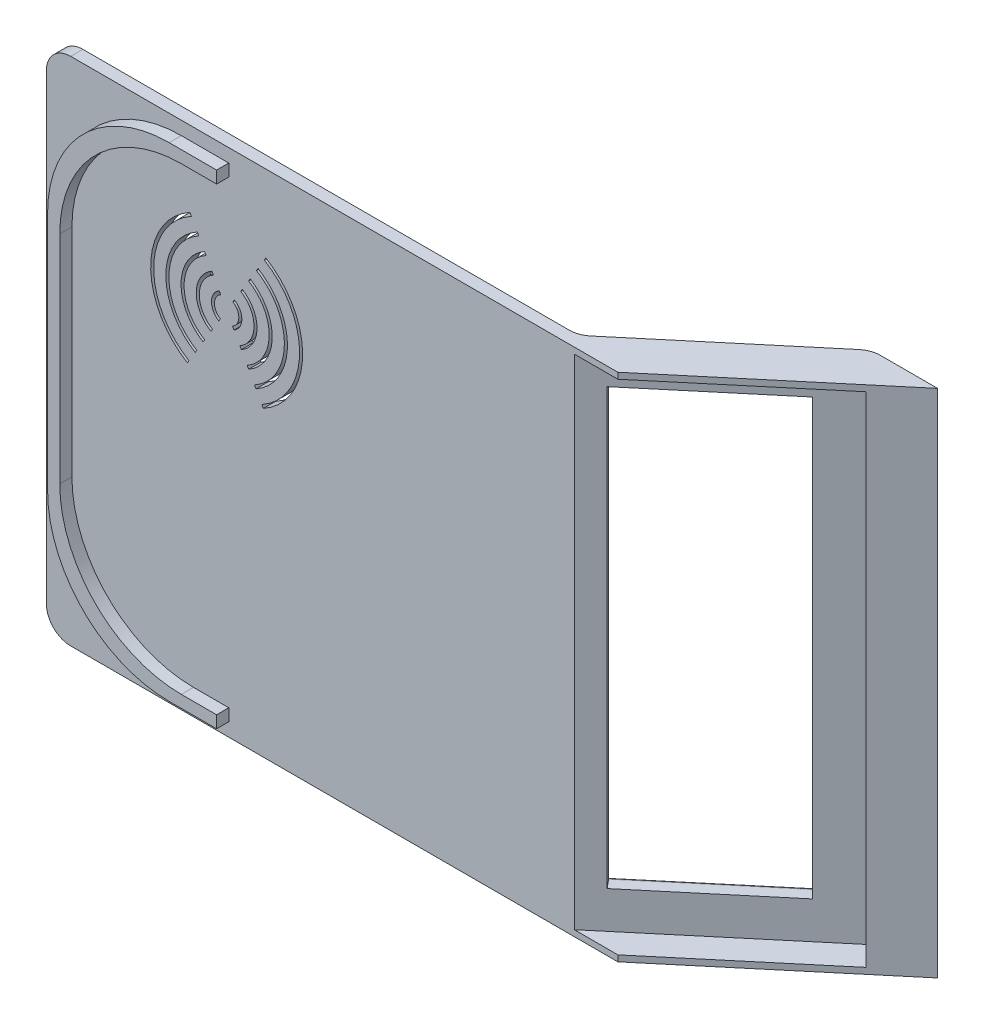
from build123d import *
from OCP.BRepFilletAPI import BRepFilletAPI_MakeFillet

# Parameters (mm, degrees)
BOSS_EXTRUDE1_DEPTH = 84
CUT_EXTRUDE2_START  = -1
CUT_EXTRUDE2_DEPTH  = 82
CUT_EXTRUDE3_START  = 4.4
CUT_EXTRUDE3_DEPTH  = 71.5
CUT_EXTRUDE4_DEPTH  = 84
FILLET2_R1          = 4
FILLET2_R2          = 0.5
BOSS_EXTRUDE3_DEPTH = 2
CUT_EXTRUDE5_DEPTH  = 4


with BuildPart() as part:
    # Sketch1 → Boss-Extrude1 (new body)
    with BuildSketch(Plane(origin=(0, 0, 0), x_dir=(1, 0, 0), z_dir=(0, 1, 0))):
        Polygon((0, 0), (38.302222156, 32.139380484), (42.801735424, 26.777069382), (8.506559603, -2), (-85.5, -2), (-85.5, 0), align=None)
    extrude(amount=BOSS_EXTRUDE1_DEPTH)

    # Sketch5 → Cut-Extrude2 (cut)
    with BuildSketch(Plane(origin=(0, 84, 0), x_dir=(1, 0, 0), z_dir=(0, 1, 0)).offset(CUT_EXTRUDE2_START)):
        Polygon((8.506559603, -2), (30.721848453, 16.640840681), (27.765025449, 20.164645119), (1.350229999, -2), align=None)
    extrude(amount=-CUT_EXTRUDE2_DEPTH, mode=Mode.SUBTRACT)

    # Sketch7 → Cut-Extrude3 (cut)
    with BuildSketch(Plane.XZ.offset(-83).offset(CUT_EXTRUDE3_START)):
        Polygon((4.285763267, -0.463204882), (-0.306577305, -5.936143258), (18.078489329, -21.363045891), (22.670829902, -15.890107515), align=None)
    extrude(amount=CUT_EXTRUDE3_DEPTH, mode=Mode.SUBTRACT)

    # Sketch8 → Cut-Extrude4 (cut)
    with BuildSketch(Plane.XZ):
        Polygon((42.801735424, -26.777069382), (37.108645825, -22), (26.218579037, -22), (38.302222156, -32.139380484), align=None)
    extrude(amount=-CUT_EXTRUDE4_DEPTH, mode=Mode.SUBTRACT)

    # Fillet2: one fillet with a radius per group of edges: ONE call of the kernel's fillet builder (fillet() takes one radius for all edges)
    fillet2_edges_1 = [part.edges().sort_by_distance(p)[0] for p in [
        (0, 42, 0),
        (-85.5, 84, 1),
        (26.218579037, 42, -22),
        (-85.5, 0, 1),
    ]]
    fillet2_edges_2 = [part.edges().sort_by_distance(p)[0] for p in [
        (11.935606321, 7.1, -10.015162862),
        (2.743073004, 42.85, -2.301711546),
        (21.128139639, 42.85, -17.728614178),
        (11.935606321, 78.6, -10.015162862),
    ]]
    fillet2 = BRepFilletAPI_MakeFillet(part.part.solid().wrapped)
    for e in fillet2_edges_1:
        fillet2.Add(FILLET2_R1, e.wrapped)
    for e in fillet2_edges_2:
        fillet2.Add(FILLET2_R2, e.wrapped)
    add(Compound.cast(fillet2.Shape()), mode=Mode.REPLACE)

    # Sketch10 → Boss-Extrude3 (add)
    with BuildSketch(Plane.XY.offset(2)):
        with BuildLine():
            Line((-55.5, 79.8), (-55.5, 81.8))
            Line((-55.5, 81.8), (-63.3, 81.8))
            ThreePointArc((-63.3, 81.8), (-77.442135624, 75.942135624), (-83.3, 61.8))
            Line((-83.3, 61.8), (-83.3, 22.2))
            ThreePointArc((-83.3, 22.2), (-77.442135624, 8.057864376), (-63.3, 2.2))
            Line((-63.3, 2.2), (-55.5, 2.2))
            Line((-55.5, 2.2), (-55.5, 4.2))
            Line((-55.5, 4.2), (-61.3, 4.2))
            ThreePointArc((-61.3, 4.2), (-75.442135624, 10.057864376), (-81.3, 24.2))
            Line((-81.3, 24.2), (-81.3, 59.8))
            ThreePointArc((-81.3, 59.8), (-75.442135624, 73.942135624), (-61.3, 79.8))
            Line((-61.3, 79.8), (-55.5, 79.8))
        make_face()
    extrude(amount=BOSS_EXTRUDE3_DEPTH)

    # Sketch11 → Cut-Extrude5 (cut)
    with BuildSketch(Plane(origin=(0, 0, 0), x_dir=(-1, 0, 0), z_dir=(0, 0, -1))):
        with BuildLine():
            ThreePointArc((49.386884986, 71.331085509), (43.350190066, 60.385387064), (49.811095522, 49.684606686))
            Line((49.811095522, 49.684606686), (50.052563318, 50.122434624))
            ThreePointArc((50.052563318, 50.122434624), (43.850094081, 60.395183787), (49.645321205, 70.903054294))
            Line((49.645321205, 70.903054294), (49.386884986, 71.331085509))
        make_face()
        with BuildLine():
            Line((62.050259679, 50.357555968), (62.308695897, 49.929524753))
            ThreePointArc((62.308695897, 49.929524753), (68.345390817, 60.875223198), (61.884485362, 71.576003576))
            Line((61.884485362, 71.576003576), (61.643017565, 71.138175638))
            ThreePointArc((61.643017565, 71.138175638), (67.845486802, 60.865426475), (62.050259679, 50.357555968))
        make_face()
        with BuildLine():
            ThreePointArc((50.679066077, 69.190929433), (45.849710141, 60.434370678), (51.018434506, 51.873746375))
            Line((51.018434506, 51.873746375), (51.259902302, 52.311574313))
            ThreePointArc((51.259902302, 52.311574313), (46.349614156, 60.4441674), (50.937502296, 68.762898218))
            Line((50.937502296, 68.762898218), (50.679066077, 69.190929433))
        make_face()
        with BuildLine():
            Line((60.758078588, 52.497712044), (61.016514806, 52.069680829))
            ThreePointArc((61.016514806, 52.069680829), (65.845870742, 60.826239584), (60.677146378, 69.386863887))
            Line((60.677146378, 69.386863887), (60.435678581, 68.949035949))
            ThreePointArc((60.435678581, 68.949035949), (65.345966727, 60.816442862), (60.758078588, 52.497712044))
        make_face()
        with BuildLine():
            ThreePointArc((51.971247168, 67.050773358), (48.349230216, 60.483354291), (52.22577349, 54.062886064))
            Line((52.22577349, 54.062886064), (52.467241286, 54.500714002))
            ThreePointArc((52.467241286, 54.500714002), (48.849134231, 60.493151014), (52.229683387, 66.622742143))
            Line((52.229683387, 66.622742143), (51.971247168, 67.050773358))
        make_face()
        with BuildLine():
            Line((59.465897497, 54.637868119), (59.724333715, 54.209836904))
            ThreePointArc((59.724333715, 54.209836904), (63.346350667, 60.777255971), (59.469807394, 67.197724198))
            Line((59.469807394, 67.197724198), (59.228339597, 66.75989626))
            ThreePointArc((59.228339597, 66.75989626), (62.846446652, 60.767459248), (59.465897497, 54.637868119))
        make_face()
        with BuildLine():
            ThreePointArc((53.26342826, 64.910617282), (50.848750292, 60.532337904), (53.433112474, 56.252025753))
            Line((53.433112474, 56.252025753), (53.67458027, 56.689853691))
            ThreePointArc((53.67458027, 56.689853691), (51.348654307, 60.542134627), (53.521864478, 64.482586067))
            Line((53.521864478, 64.482586067), (53.26342826, 64.910617282))
        make_face()
        with BuildLine():
            Line((58.173716406, 56.778024195), (58.432152624, 56.34999298))
            ThreePointArc((58.432152624, 56.34999298), (60.846830592, 60.728272358), (58.26246841, 65.008584509))
            Line((58.26246841, 65.008584509), (58.021000613, 64.570756571))
            ThreePointArc((58.021000613, 64.570756571), (60.346926577, 60.718475635), (58.173716406, 56.778024195))
        make_face()
        with BuildLine():
            ThreePointArc((54.555609351, 62.770461207), (53.348270367, 60.581321518), (54.640451458, 58.441165442))
            Line((54.640451458, 58.441165442), (54.881919254, 58.87899338))
            ThreePointArc((54.881919254, 58.87899338), (53.848174382, 60.59111824), (54.814045569, 62.342429991))
            Line((54.814045569, 62.342429991), (54.555609351, 62.770461207))
        make_face()
        with BuildLine():
            Line((56.881535314, 58.91818027), (57.139971533, 58.490149055))
            ThreePointArc((57.139971533, 58.490149055), (58.347310517, 60.679288744), (57.055129426, 62.81944482))
            Line((57.055129426, 62.81944482), (56.813661629, 62.381616882))
            ThreePointArc((56.813661629, 62.381616882), (57.847406502, 60.669492022), (56.881535314, 58.91818027))
        make_face()
    extrude(amount=-CUT_EXTRUDE5_DEPTH, mode=Mode.SUBTRACT)


solid = part.part
